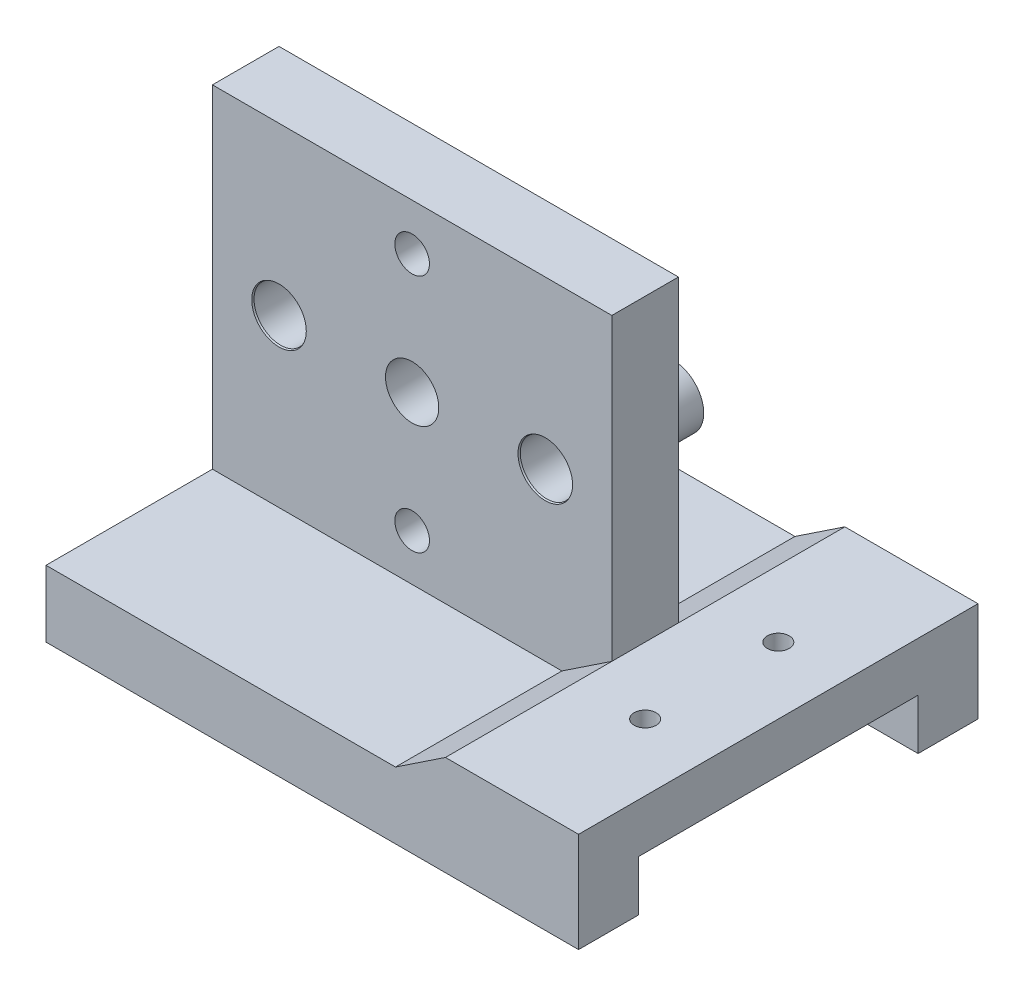
from build123d import *

# Parameters (mm, degrees)
SKETCH_1_W                = 60
SKETCH_1_H                = 50
EXTRUDE_1_DEPTH           = 10
HOLE_WIZARD_2_D           = 8
HOLE_WIZARD_2_CSINK_D     = 8.2
HOLE_WIZARD_2_CSINK_ANGLE = 45
HOLE_WIZARD_3_D           = 5.2
SKETCH_8_W                = 80
SKETCH_8_H                = 60
EXTRUDE_2_DEPTH           = 10
SKETCH_11_W               = 20
SKETCH_11_H               = 7.6
CUT_EXTRUDE_1_DEPTH       = 21
SKETCH_12_W               = 20
SKETCH_12_H               = 5
EXTRUDE_4_DEPTH           = 30
HOLE_WIZARD_4_D           = 3.3
EXTRUDE_START             = -60
EXTRUDE_5_DEPTH           = 60
HOLE_WIZARD_5_D           = 8
HOLE_WIZARD_5_CSINK_D     = 8.5
HOLE_WIZARD_5_CSINK_ANGLE = 45
HOLE_WIZARD_6_D           = 8
HOLE_WIZARD_6_CSINK_D     = 8.2
HOLE_WIZARD_6_CSINK_ANGLE = 45
SKETCH_22_R               = 4.6
SKETCH_22_R_2             = 4.1
EXTRUDE_7_DEPTH           = 9.2


with BuildPart() as part:
    # 草图1 → 凸台-拉伸1 (new body)
    with BuildSketch(Plane.XY):
        Rectangle(SKETCH_1_W, SKETCH_1_H)
    extrude(amount=EXTRUDE_1_DEPTH)

    # 孔2 (through all)
    with Locations(Plane.XY.offset(10)):
        with Locations((20, 0), (-20, 0)):
            CounterSinkHole(HOLE_WIZARD_2_D / 2, HOLE_WIZARD_2_CSINK_D / 2, counter_sink_angle=HOLE_WIZARD_2_CSINK_ANGLE)

    # 孔3 (through all)
    with Locations(Plane(origin=(0, 0, 0), x_dir=(-1, 0, 0), z_dir=(0, 0, -1))):
        with Locations((0, 18), (0, -18)):
            Hole(HOLE_WIZARD_3_D / 2)

    # 草图8 → 凸台-拉伸2 (add)
    with BuildSketch(Plane.XZ.offset(25)):
        with Locations((10, 5)):
            Rectangle(SKETCH_8_W, SKETCH_8_H)
    extrude(amount=EXTRUDE_2_DEPTH)

    # 草图11 → 切除-拉伸1 (cut, symmetric)
    with BuildSketch(Plane.XY.offset(5)):
        with Locations((40, -31.2)):
            Rectangle(SKETCH_11_W, SKETCH_11_H)
    extrude(amount=CUT_EXTRUDE_1_DEPTH, both=True, mode=Mode.SUBTRACT)

    # 草图12 → 凸台-拉伸4 (add, symmetric)
    with BuildSketch(Plane.XY.offset(5)):
        with Locations((40, -22.5)):
            Rectangle(SKETCH_12_W, SKETCH_12_H)
    extrude(amount=EXTRUDE_4_DEPTH, both=True)

    # 孔4 (through all)
    with Locations(Plane(origin=(0, -20, 0), x_dir=(1, 0, 0), z_dir=(0, 1, 0))):
        with Locations((40, -15), (40, 5)):
            Hole(HOLE_WIZARD_4_D / 2)

    # 草图15 → 凸台-拉伸5 (add)
    with BuildSketch(Plane.XY.offset(35).offset(EXTRUDE_START)):
        Polygon((30, -20), (22.5, -25), (30, -25), align=None)
    extrude(amount=EXTRUDE_5_DEPTH)

    # 孔5 (through all)
    with Locations(Plane(origin=(0, 0, 0), x_dir=(-1, 0, 0), z_dir=(0, 0, -1))):
        with Locations((0, 0)):
            CounterSinkHole(HOLE_WIZARD_5_D / 2, HOLE_WIZARD_5_CSINK_D / 2, counter_sink_angle=HOLE_WIZARD_5_CSINK_ANGLE)

    # 孔6 (through all)
    with Locations(Plane(origin=(0, 0, 0), x_dir=(-1, 0, 0), z_dir=(0, 0, -1))):
        with Locations((-20, 0), (20, 0)):
            CounterSinkHole(HOLE_WIZARD_6_D / 2, HOLE_WIZARD_6_CSINK_D / 2, counter_sink_angle=HOLE_WIZARD_6_CSINK_ANGLE)

    # 草图22 → 凸台-拉伸7 (add)
    # profile 1 of 2: a face of its own
    with BuildSketch(Plane(origin=(0, 0, 0), x_dir=(-1, 0, 0), z_dir=(0, 0, -1))):
        with Locations((-20, 0)):
            Circle(SKETCH_22_R)
        with Locations((-20, 0)):
            Circle(SKETCH_22_R_2, mode=Mode.SUBTRACT)
    # profile 2 of 2: a face of its own
    with BuildSketch(Plane(origin=(0, 0, 0), x_dir=(-1, 0, 0), z_dir=(0, 0, -1))):
        with Locations((20, 0)):
            Circle(SKETCH_22_R)
        with Locations((20, 0)):
            Circle(SKETCH_22_R_2, mode=Mode.SUBTRACT)
    extrude(amount=EXTRUDE_7_DEPTH)


solid = part.part
